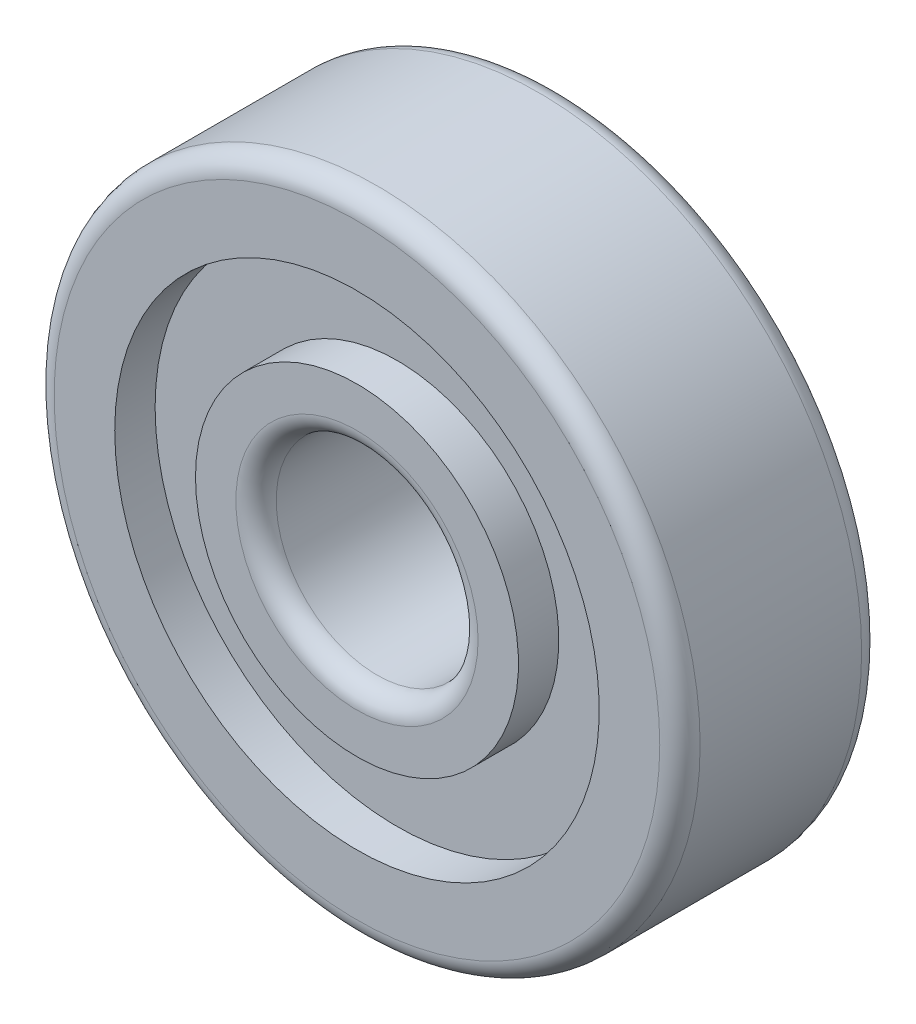
from build123d import *

# Parameters (mm, degrees)
SKETCH_3_R          = 8
SKETCH_3_R_2        = 2.5
EXTRUDE_1_DEPTH     = 2.5
FILLET_1_R          = 0.5
SKETCH_4_R          = 6
SKETCH_4_R_2        = 4
CUT_EXTRUDE_1_DEPTH = 1


with BuildPart() as part:
    # 草圖3 → 填料-伸長1 (new, symmetric)
    with BuildSketch(Plane.XY):
        Circle(SKETCH_3_R)
        Circle(SKETCH_3_R_2, mode=Mode.SUBTRACT)
    extrude(amount=EXTRUDE_1_DEPTH, both=True)

    # 圓角1
    fillet_1_edges = [part.edges().sort_by_distance(p)[0] for p in [
        (-8, 0, -2.5),
        (-8, 0, 2.5),
        (-2.5, 0, -2.5),
        (-2.5, 0, 2.5),
    ]]
    fillet(fillet_1_edges, radius=FILLET_1_R)

    # 草圖4 → 除料-伸長1 (cut)
    with BuildSketch(Plane(origin=(0, 0, -2.5), x_dir=(-1, 0, 0), z_dir=(0, 0, -1))):
        Circle(SKETCH_4_R)
        Circle(SKETCH_4_R_2, mode=Mode.SUBTRACT)
    cut_extrude_1 = extrude(amount=-CUT_EXTRUDE_1_DEPTH, mode=Mode.SUBTRACT)

    # 鏡射1: 除料-伸長1 across plane
    add(cut_extrude_1.mirror(Plane.XY), mode=Mode.SUBTRACT)


solid = part.part
